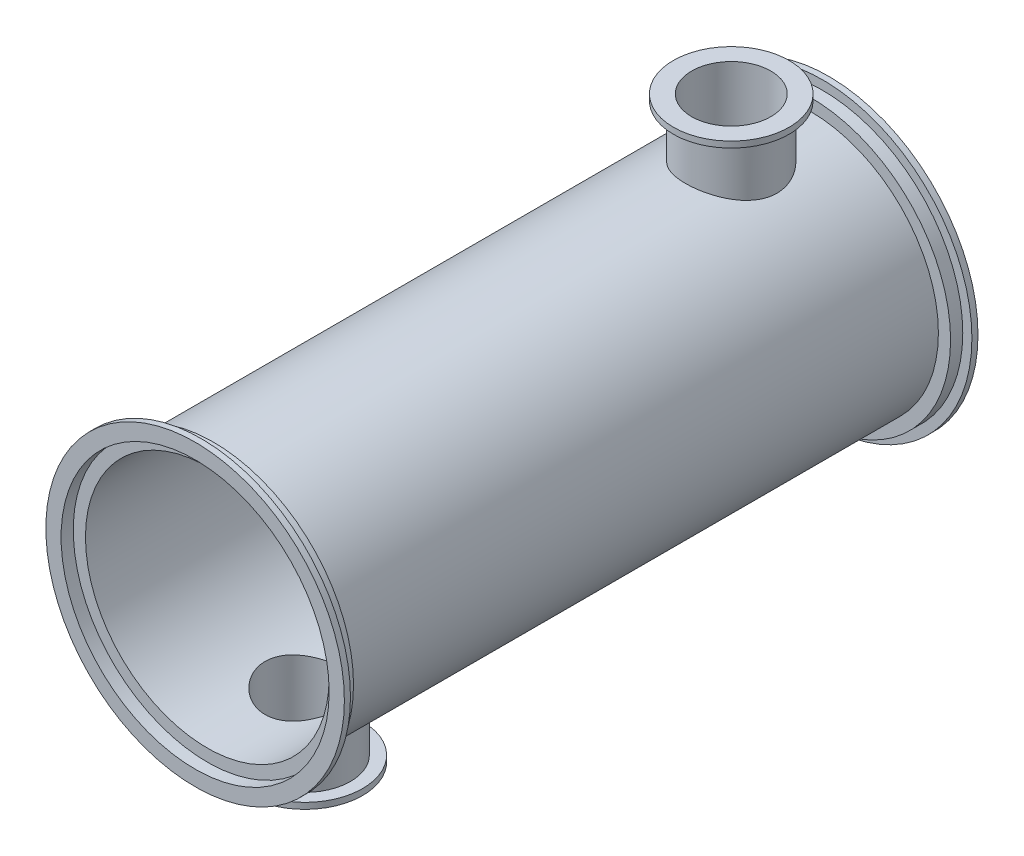
from build123d import *

# Parameters (mm, degrees)
BOSS_EXTRUDE4_REACH      = 926.86
BOSS_EXTRUDE4_END_RADIUS = 210
BOSS_EXTRUDE4_START      = 300
SKETCH3_R                = 75
SKETCH3_R_2              = 65
CUT_EXTRUDE2_REACH       = 794.117
SKETCH4_R                = 65
SKETCH6_R                = 95
SKETCH6_R_2              = 65
BOSS_EXTRUDE5_DEPTH      = 10
BOSS_EXTRUDE7_REACH      = 832.918
BOSS_EXTRUDE7_END_RADIUS = 210
SKETCH8_R                = 75
SKETCH8_R_2              = 65
CUT_EXTRUDE3_REACH       = 832.918
SKETCH9_R                = 65
SKETCH10_R               = 95
SKETCH10_R_2             = 75
BOSS_EXTRUDE8_DEPTH      = 10


with BuildPart() as part:
    # Sketch1 → Revolve1 (revolve)
    with BuildSketch(Plane(origin=(0, 0, 0), x_dir=(0, 0, -1), z_dir=(1, 0, 0)), mode=Mode.PRIVATE) as revolve1_sk:
        Polygon((500, 200), (-500, 200), (-500, 220), (-520, 220), (-520, 245), (-510, 245), (-510, 230), (-490, 230), (-490, 210), (490, 210), (490, 230), (510, 230), (510, 245), (520, 245), (520, 220), (500, 220), align=None)
    revolve(revolve1_sk.sketch.rotate(Axis((0, 0, 500), (0, 0, -1)), 90), axis=Axis((0, 0, 500), (0, 0, -1)))

    # Boss-Extrude4: up to this cylinder (the profile starts outside it)
    boss_extrude4_end = Plane(origin=(0, 0, -432.87868), z_dir=(0, 0, 1)) * Cylinder(BOSS_EXTRUDE4_END_RADIUS, 2274.72, mode=Mode.PRIVATE)
    # Sketch3 → Boss-Extrude4 (add, up to the surface)
    with BuildSketch(Plane(origin=(0, 0, 0), x_dir=(1, 0, 0), z_dir=(0, 1, 0)).offset(BOSS_EXTRUDE4_START), mode=Mode.PRIVATE) as boss_extrude4_sk1:
        with Locations(Location((0, 360, 0), (0, 0, 270))):
            Circle(SKETCH3_R)
        with Locations(Location((0, 360, 0), (0, 0, 270))):
            Circle(SKETCH3_R_2, mode=Mode.SUBTRACT)
    boss_extrude4_tool1 = extrude(boss_extrude4_sk1.sketch, amount=-BOSS_EXTRUDE4_REACH, mode=Mode.PRIVATE) - boss_extrude4_end
    add(boss_extrude4_tool1.solids().sort_by_distance((0, 300, -432.87868))[0])

    # Sketch4 → Cut-Extrude2 (cut, up to next)
    with BuildSketch(Plane(origin=(0, 300, 0), x_dir=(1, 0, 0), z_dir=(0, 1, 0)), mode=Mode.PRIVATE) as cut_extrude2_sk1:
        with Locations(Location((0, 360, 0), (0, 0, 270))):
            Circle(SKETCH4_R)
    cut_extrude2_tool1 = extrude(cut_extrude2_sk1.sketch, amount=-CUT_EXTRUDE2_REACH, mode=Mode.PRIVATE) & part.part
    add(cut_extrude2_tool1.solids().sort_by_distance((0, 300, -360))[0], mode=Mode.SUBTRACT)

    # Sketch6 → Boss-Extrude5 (add)
    with BuildSketch(Plane(origin=(0, 300, 0), x_dir=(1, 0, 0), z_dir=(0, 1, 0))):
        with Locations(Location((0, 360, 0), (0, 0, 270))):
            Circle(SKETCH6_R)
        with Locations(Location((0, 360, 0), (0, 0, 270))):
            Circle(SKETCH6_R_2, mode=Mode.SUBTRACT)
    extrude(amount=-BOSS_EXTRUDE5_DEPTH)

    # Boss-Extrude7: up to this cylinder (the profile starts outside it)
    boss_extrude7_end = Plane(origin=(0, 0, 412.87868), z_dir=(0, 0, 1)) * Cylinder(BOSS_EXTRUDE7_END_RADIUS, 2086.836, mode=Mode.PRIVATE)
    # Sketch8 → Boss-Extrude7 (add, up to the surface)
    with BuildSketch(Plane(origin=(0, -300, 0), x_dir=(1, 0, 0), z_dir=(0, 1, 0)), mode=Mode.PRIVATE) as boss_extrude7_sk1:
        with Locations(Location((0, -340, 0), (0, 0, 90))):
            Circle(SKETCH8_R)
        with Locations(Location((0, -340, 0), (0, 0, 90))):
            Circle(SKETCH8_R_2, mode=Mode.SUBTRACT)
    boss_extrude7_tool1 = extrude(boss_extrude7_sk1.sketch, amount=BOSS_EXTRUDE7_REACH, mode=Mode.PRIVATE) - boss_extrude7_end
    add(boss_extrude7_tool1.solids().sort_by_distance((0, -300, 412.87868))[0])

    # Sketch9 → Cut-Extrude3 (cut, up to next)
    with BuildSketch(Plane.XZ.offset(300), mode=Mode.PRIVATE) as cut_extrude3_sk1:
        with Locations(Location((0, 340, 0), (0, 0, 270))):
            Circle(SKETCH9_R)
    cut_extrude3_tool1 = extrude(cut_extrude3_sk1.sketch, amount=-CUT_EXTRUDE3_REACH, mode=Mode.PRIVATE) & part.part
    add(cut_extrude3_tool1.solids().sort_by_distance((0, -300, 340))[0], mode=Mode.SUBTRACT)

    # Sketch10 → Boss-Extrude8 (add)
    with BuildSketch(Plane.XZ.offset(300)):
        with Locations(Location((0, 340, 0), (0, 0, 270))):
            Circle(SKETCH10_R)
        with Locations(Location((0, 340, 0), (0, 0, 270))):
            Circle(SKETCH10_R_2, mode=Mode.SUBTRACT)
    extrude(amount=-BOSS_EXTRUDE8_DEPTH)


solid = part.part
